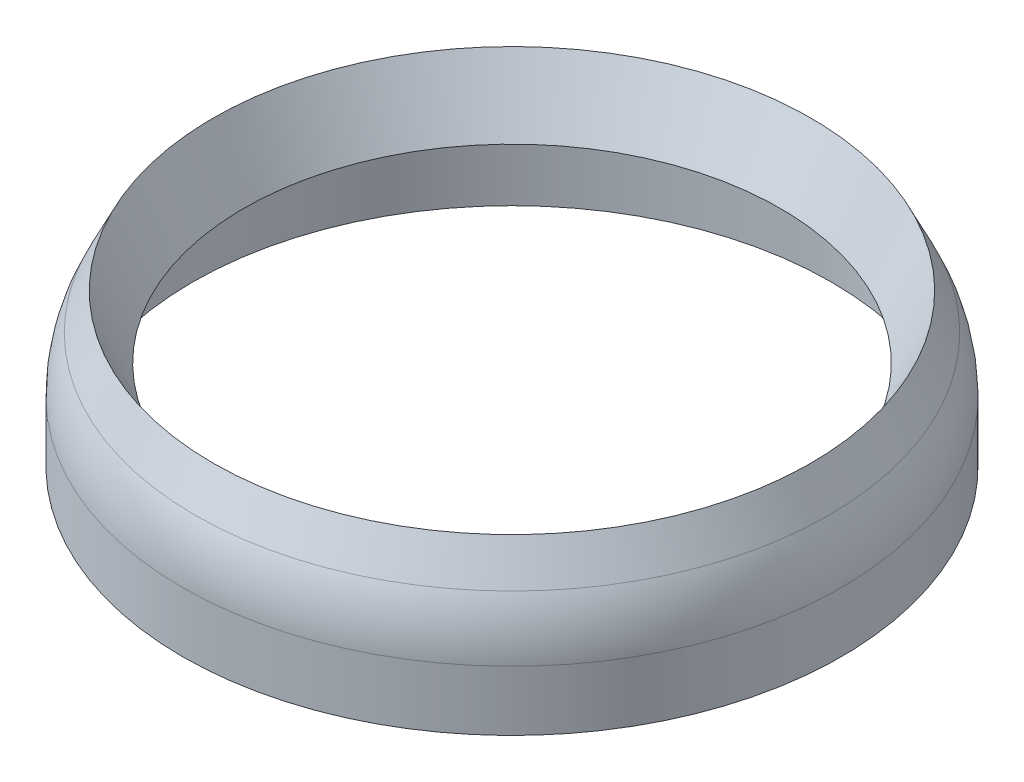
from build123d import *

# Parameters (mm, degrees)
SKETCH1_R           = 25.8
SKETCH1_R_2         = 25
BOSS_EXTRUDE1_DEPTH = 7
SKETCH2_R           = 25.8
SKETCH2_R_2         = 21
BOSS_EXTRUDE2_DEPTH = 5
BOSS_EXTRUDE2_TAPER = 26
FILLET3_R           = 10


with BuildPart() as part:
    # Sketch1 → Boss-Extrude1 (new body)
    with BuildSketch(Plane(origin=(0, 0, 0), x_dir=(1, 0, 0), z_dir=(0, 1, 0))):
        with Locations(Location((0, 0, 0), (0, 0, 270))):
            Circle(SKETCH1_R)
        with Locations(Location((0, 0, 0), (0, 0, 270))):
            Circle(SKETCH1_R_2, mode=Mode.SUBTRACT)
    extrude(amount=-BOSS_EXTRUDE1_DEPTH)

    # Sketch2 → Boss-Extrude2 (add)
    with BuildSketch(Plane(origin=(0, 0, 0), x_dir=(1, 0, 0), z_dir=(0, 1, 0))):
        with Locations(Location((0, 0, 0), (0, 0, 270))):
            Circle(SKETCH2_R)
        Circle(SKETCH2_R_2, mode=Mode.SUBTRACT)
    extrude(amount=BOSS_EXTRUDE2_DEPTH, taper=BOSS_EXTRUDE2_TAPER)

    # Fillet3
    fillet3_edges = [part.edges().sort_by_distance(p)[0] for p in [
        (0, 0, -25.8),
    ]]
    fillet(fillet3_edges, radius=FILLET3_R)


solid = part.part
